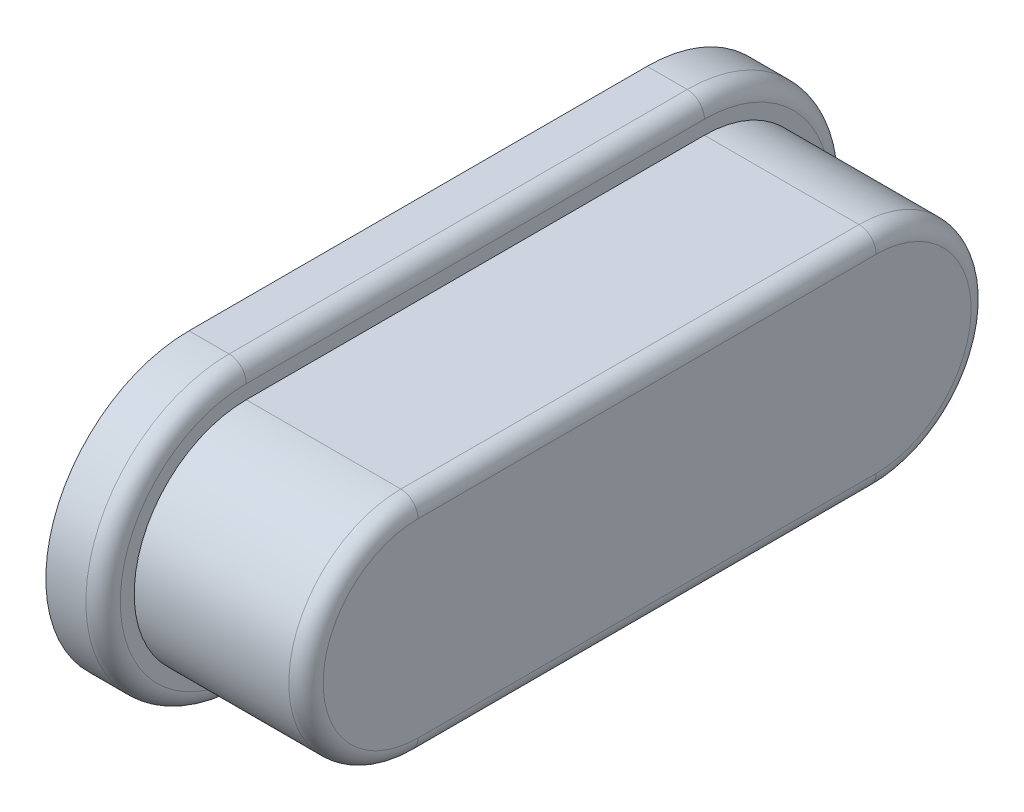
from build123d import *

# Parameters (mm, degrees)
EXTRUDE_1_DEPTH = 1
EXTRUDE_2_DEPTH = 3
FILLET_1_R      = 0.3


with BuildPart() as part:
    # 草图1 → 凸台-拉伸1 (new body)
    with BuildSketch(Plane(origin=(0, 0, 0), x_dir=(0, 0, -1), z_dir=(1, 0, 0))):
        with BuildLine():
            Line((0, 2.5), (8, 2.5))
            ThreePointArc((8, 2.5), (10.5, 0), (8, -2.5))
            Line((8, -2.5), (0, -2.5))
            ThreePointArc((0, -2.5), (-2.5, 0), (0, 2.5))
        make_face()
    extrude(amount=EXTRUDE_1_DEPTH)

    # 草图2 → 凸台-拉伸2 (add)
    with BuildSketch(Plane(origin=(1, 0, 0), x_dir=(0, 0, -1), z_dir=(1, 0, 0))):
        with BuildLine():
            Line((0, 1.957135809), (8, 1.957135809))
            ThreePointArc((8, 1.957135809), (9.957135809, 0), (8, -1.957135809))
            Line((8, -1.957135809), (0, -1.957135809))
            ThreePointArc((0, -1.957135809), (-1.957135809, 0), (0, 1.957135809))
        make_face()
    extrude(amount=EXTRUDE_2_DEPTH)

    # 圆角1
    fillet_1_edges = [part.edges().sort_by_distance(p)[0] for p in [
        (1, 0, -10.5),
        (1, 2.5, -4),
        (4, 0, 1.957135809),
        (4, -1.957135809, -4),
        (4, 0, -9.957135809),
        (4, 1.957135809, -4),
        (1, 0, 2.5),
        (1, -2.5, -4),
    ]]
    fillet(fillet_1_edges, radius=FILLET_1_R)


solid = part.part
